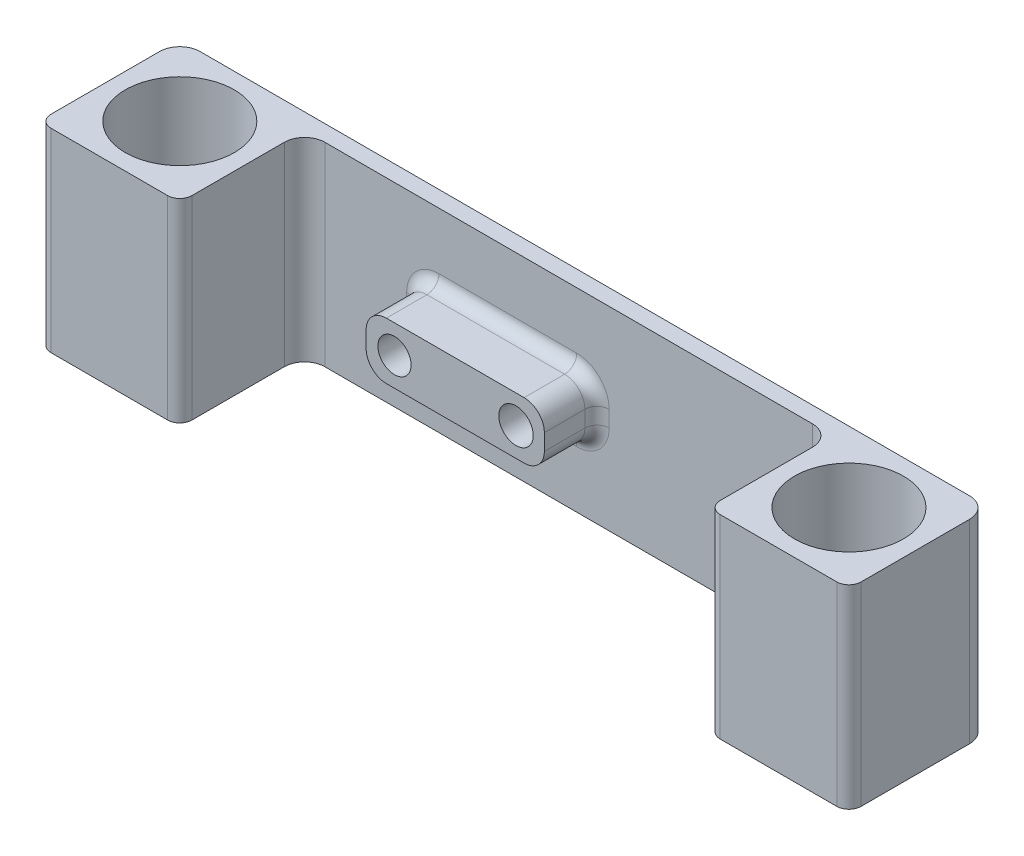
from build123d import *

# Parameters (mm, degrees)
SKETCH1_R           = 13.45
BOSS_EXTRUDE2_DEPTH = 48
SKETCH7_W           = 44
SKETCH7_H           = 14
SKETCH7_R           = 4.25
SKETCH7_R_2         = 4.1
BOSS_EXTRUDE3_DEPTH = 13
FILLET1_R           = 3
FILLET2_R           = 5
FILLET3_R           = 5
FILLET4_R           = 3


with BuildPart() as part:
    # Sketch1 → Boss-Extrude2 (new body)
    with BuildSketch(Plane(origin=(0, 0, 0), x_dir=(1, 0, 0), z_dir=(0, 1, 0))):
        Polygon((-17.4, 17.4), (17.4, 17.4), (17.4, -17.4), (-17.4, -17.4), (-17.4, 13.4), (-82.6, 13.4), (-82.6, 17.4), align=None)
        with Locations(Location((0, 0, 0), (0, 0, 270))):
            Circle(SKETCH1_R, mode=Mode.SUBTRACT)
    boss_extrude2 = extrude(amount=BOSS_EXTRUDE2_DEPTH)

    # Mirror2: Boss-Extrude2 across plane
    add(boss_extrude2.mirror(Plane(origin=(-82.6, 48, -17.4), x_dir=(0, 0, 1), z_dir=(1, 0, 0))))

    # Sketch7 → Boss-Extrude3 (add)
    with BuildSketch(Plane.XY.offset(-13.4)):
        with Locations((-97.6, 24)):
            Rectangle(SKETCH7_W, SKETCH7_H)
        with Locations(Location((-82.6, 24, 0), (0, 0, 180))):
            Circle(SKETCH7_R, mode=Mode.SUBTRACT)
        with Locations(Location((-112.6, 24, 0), (0, 0, 180))):
            Circle(SKETCH7_R_2, mode=Mode.SUBTRACT)
    extrude(amount=BOSS_EXTRUDE3_DEPTH)

    # Fillet1
    fillet1_edges = [part.edges().sort_by_distance(p)[0] for p in [
        (17.4, 24, 17.4),
        (-17.4, 24, 17.4),
        (-182.6, 24, 17.4),
        (-147.8, 24, 17.4),
    ]]
    fillet(fillet1_edges, radius=FILLET1_R)

    # Fillet2
    fillet2_edges = [part.edges().sort_by_distance(p)[0] for p in [
        (-17.4, 24, -13.4),
        (17.4, 24, -17.4),
        (-182.6, 24, -17.4),
        (-147.8, 24, -13.4),
    ]]
    fillet(fillet2_edges, radius=FILLET2_R)

    # Fillet3
    fillet3_edges = [part.edges().sort_by_distance(p)[0] for p in [
        (-75.6, 17, -6.9),
        (-75.6, 31, -6.9),
        (-119.6, 31, -6.9),
        (-119.6, 17, -6.9),
    ]]
    fillet(fillet3_edges, radius=FILLET3_R)

    # Fillet4
    fillet4_edges = [part.edges().sort_by_distance(p)[0] for p in [
        (-97.6, 31, -13.4),
        (-75.6, 24, -13.4),
        (-97.6, 17, -13.4),
        (-119.6, 24, -13.4),
        (-77.064466094, 29.535533906, -13.4),
        (-77.064466094, 18.464466094, -13.4),
        (-118.135533906, 29.535533906, -13.4),
        (-118.135533906, 18.464466094, -13.4),
    ]]
    fillet(fillet4_edges, radius=FILLET4_R)


solid = part.part
